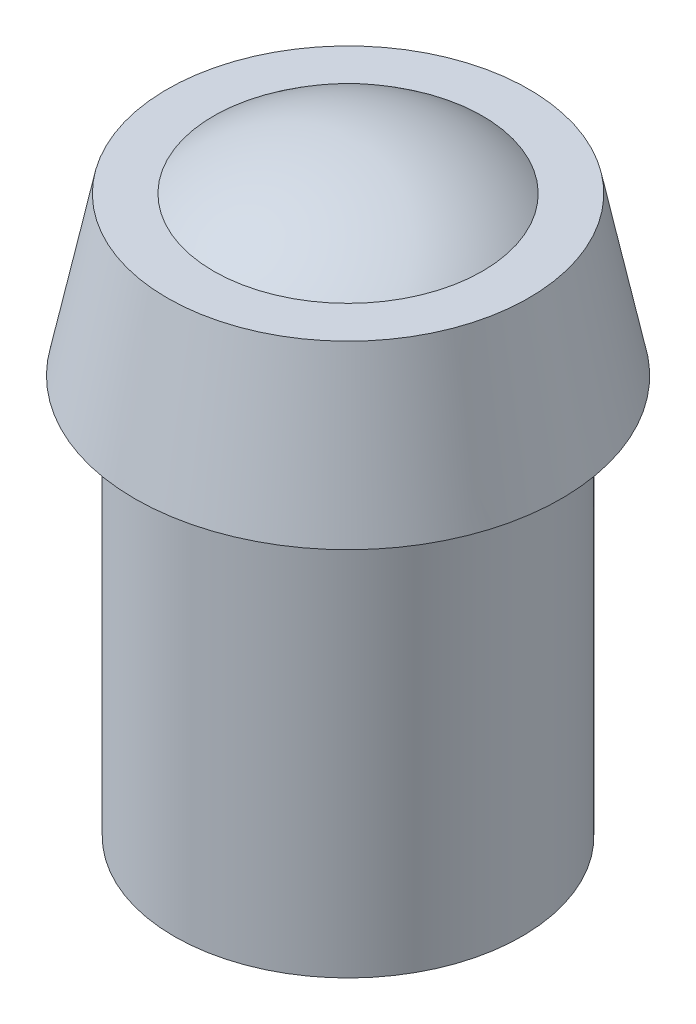
from build123d import *


with BuildPart() as part:
    # Sketch1 → Revolve1 (revolve)
    with BuildSketch(Plane.XY, mode=Mode.PRIVATE) as revolve1_sk:
        Polygon((0, 0), (3.9, 0), (4.6, -3.4), (3.75, -3.4), (3.75, -12), (0, -12), align=None)
    revolve(revolve1_sk.sketch.rotate(Axis((0, 0, 0), (0, -1, 0)), 90), axis=Axis((0, 0, 0), (0, -1, 0)))

    # Sketch2 → Revolve2 (revolve)
    with BuildSketch(Plane.XY, mode=Mode.PRIVATE) as revolve2_sk:
        with BuildLine():
            Line((0, 1), (0, 0))
            Line((0, 0), (-2.9, 0))
            ThreePointArc((-2.9, 0), (-1.533786165, 0.742979879), (0, 1))
        make_face()
    revolve(revolve2_sk.sketch.rotate(Axis((0, 1, 0), (0, -1, 0)), 180), axis=Axis((0, 1, 0), (0, -1, 0)))


solid = part.part
